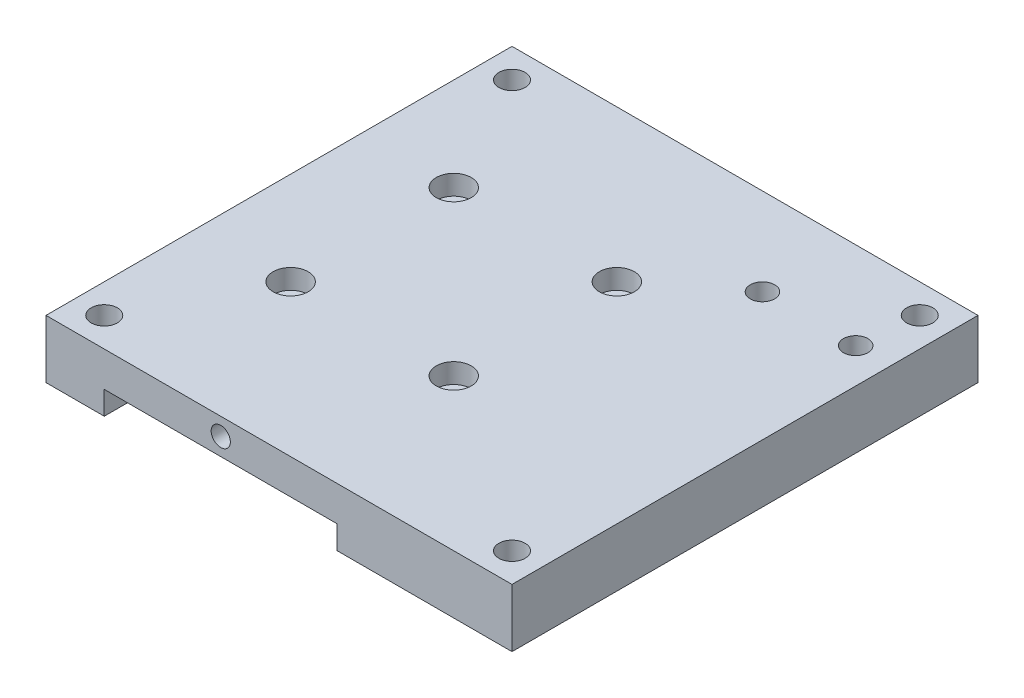
from build123d import *

# Parameters (mm, degrees)
SKETCH_1_W                = 80
SKETCH_1_H                = 80
EXTRUDE_1_DEPTH           = 10
SKETCH_2_W                = 40
SKETCH_2_H                = 4
CUT_EXTRUDE_1_DEPTH       = 91
HOLE_WIZARD_1_D           = 3.4
HOLE_WIZARD_1_CBORE_D     = 6
HOLE_WIZARD_1_CBORE_DEPTH = 3.4
HOLE_WIZARD_M5_1_D        = 4.2
HOLE_WIZARD_2_D           = 4.5
HOLE_WIZARD_2_CBORE_D     = 8
HOLE_WIZARD_2_CBORE_DEPTH = 5
HOLE_WIZARD_M4_1_D        = 3.3
HOLE_WIZARD_M4_1_DEPTH    = 10.1
HOLE_WIZARD_M4_1_TIP      = 0.991420021


with BuildPart() as part:
    # 草图1 → 凸台-拉伸1 (new body)
    with BuildSketch(Plane(origin=(0, 0, 0), x_dir=(1, 0, 0), z_dir=(0, 1, 0))):
        Rectangle(SKETCH_1_W, SKETCH_1_H)
    extrude(amount=EXTRUDE_1_DEPTH)

    # 草图2 → 切除-拉伸1 (cut, through all)
    with BuildSketch(Plane.XY.offset(40)):
        with Locations((-10, 2)):
            Rectangle(SKETCH_2_W, SKETCH_2_H)
    extrude(amount=-CUT_EXTRUDE_1_DEPTH, mode=Mode.SUBTRACT)

    # 打孔尺寸根据内六角圆柱头螺钉的类型1 (through all)
    with Locations(Plane(origin=(0, 10, 0), x_dir=(1, 0, 0), z_dir=(0, 1, 0))):
        with Locations((-24, 14), (4, 14), (4, -14), (-24, -14)):
            CounterBoreHole(HOLE_WIZARD_1_D / 2, HOLE_WIZARD_1_CBORE_D / 2, HOLE_WIZARD_1_CBORE_DEPTH)

    # M5 螺纹孔1 (through all)
    with Locations(Plane(origin=(0, 0, 0), x_dir=(-1, 0, 0), z_dir=(0, -1, 0))):
        with Locations((-18, 25), (-34, 25)):
            Hole(HOLE_WIZARD_M5_1_D / 2)

    # 打孔尺寸根据内六角圆柱头螺钉的类型2 (through all)
    with Locations(Plane(origin=(0, 0, 0), x_dir=(-1, 0, 0), z_dir=(0, -1, 0))):
        with Locations((35, -35), (-35, -35), (-35, 35), (35, 35)):
            CounterBoreHole(HOLE_WIZARD_2_D / 2, HOLE_WIZARD_2_CBORE_D / 2, HOLE_WIZARD_2_CBORE_DEPTH)

    # M4 螺纹孔1
    with Locations(Plane.XY.offset(40)):
        with Locations((-10, 7)):
            Hole(HOLE_WIZARD_M4_1_D / 2, depth=HOLE_WIZARD_M4_1_DEPTH)
            with Locations((0, 0, -(HOLE_WIZARD_M4_1_DEPTH + HOLE_WIZARD_M4_1_TIP / 2))):  # 118° drill point
                Cone(0, HOLE_WIZARD_M4_1_D / 2, HOLE_WIZARD_M4_1_TIP, mode=Mode.SUBTRACT)


solid = part.part
